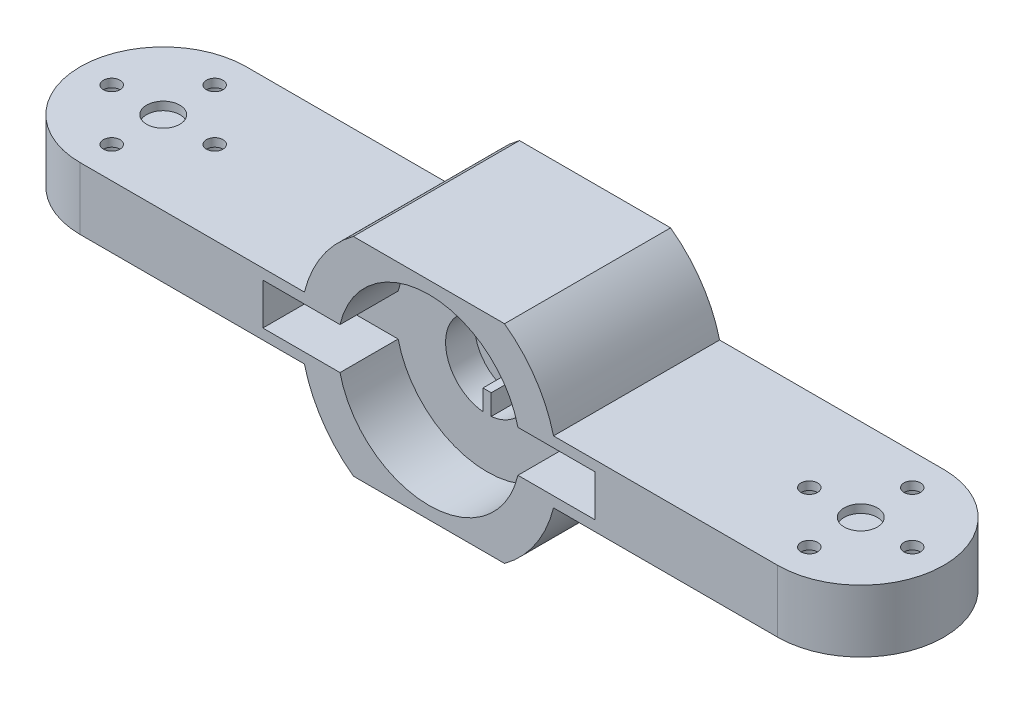
from build123d import *

# Parameters (mm, degrees)
BOSS_EXTRUDE1_DEPTH = 25
SKETCH2_R           = 11
CUT_EXTRUDE1_DEPTH  = 7
CUT_EXTRUDE3_DEPTH  = 8.75
CUT_EXTRUDE5_DEPTH  = 8.75
SKETCH5_R           = 1
CUT_EXTRUDE6_DEPTH  = 7.5
SKETCH6_R           = 1.95
CUT_EXTRUDE7_DEPTH  = 6.5
SKETCH7_R           = 2
CUT_EXTRUDE8_DEPTH  = 1
CUT_EXTRUDE9_DEPTH  = 62.065538563
CUT_EXTRUDE10_DEPTH = 3.5
SKETCH10_W          = 40
SKETCH10_H          = 5
CUT_EXTRUDE11_DEPTH = 7


with BuildPart() as part:
    # Sketch1 → Boss-Extrude1 (new body)
    with BuildSketch(Plane(origin=(0, 0, 0), x_dir=(1, 0, 0), z_dir=(0, 1, 0))):
        with BuildLine():
            Line((-42, -10), (42, -10))
            ThreePointArc((42, -10), (52, 0), (42, 10))
            Line((42, 10), (-42, 10))
            ThreePointArc((-42, 10), (-52, 0), (-42, -10))
        make_face()
    extrude(amount=BOSS_EXTRUDE1_DEPTH)

    # Sketch2 → Cut-Extrude1 (cut)
    with BuildSketch(Plane.XY.offset(10)):
        with Locations((0, 12.5)):
            Circle(SKETCH2_R)
    extrude(amount=-CUT_EXTRUDE1_DEPTH, mode=Mode.SUBTRACT)

    # Sketch3 → Cut-Extrude3 (cut)
    with BuildSketch(Plane.XZ):
        with BuildLine():
            Line((15, -10), (15, 10))
            Line((15, 10), (42, 10))
            ThreePointArc((42, 10), (52, 0), (42, -10))
            Line((42, -10), (15, -10))
        make_face()
        with BuildLine():
            Line((-15, -10), (-15, 10))
            Line((-15, 10), (-42, 10))
            ThreePointArc((-42, 10), (-52, 0), (-42, -10))
            Line((-42, -10), (-15, -10))
        make_face()
    extrude(amount=-CUT_EXTRUDE3_DEPTH, mode=Mode.SUBTRACT)

    # Sketch4 → Cut-Extrude5 (cut)
    with BuildSketch(Plane(origin=(0, 25, 0), x_dir=(1, 0, 0), z_dir=(0, 1, 0))):
        with BuildLine():
            Line((15, -10), (15, 10))
            Line((15, 10), (55, 10))
            ThreePointArc((55, 10), (65, 0), (55, -10))
            Line((55, -10), (15, -10))
        make_face()
        with BuildLine():
            Line((-15, -10), (-15, 10))
            Line((-15, 10), (-55, 10))
            ThreePointArc((-55, 10), (-65, 0), (-55, -10))
            Line((-55, -10), (-15, -10))
        make_face()
    extrude(amount=-CUT_EXTRUDE5_DEPTH, mode=Mode.SUBTRACT)

    # Sketch5 → Cut-Extrude6 (cut)
    with BuildSketch(Plane(origin=(0, 16.25, 0), x_dir=(1, 0, 0), z_dir=(0, 1, 0))):
        with Locations(Location((-42, 6.2, 0), (0, 0, 270))):
            Circle(SKETCH5_R)
        with Locations(Location((-35.8, 0, 0), (0, 0, 270))):
            Circle(SKETCH5_R)
        with Locations(Location((-42, -6.2, 0), (0, 0, 270))):
            Circle(SKETCH5_R)
        with Locations(Location((-48.2, 0, 0), (0, 0, 270))):
            Circle(SKETCH5_R)
        with Locations(Location((42, 6.2, 0), (0, 0, 270))):
            Circle(SKETCH5_R)
        with Locations(Location((48.2, 0, 0), (0, 0, 270))):
            Circle(SKETCH5_R)
        with Locations(Location((42, -6.2, 0), (0, 0, 270))):
            Circle(SKETCH5_R)
        with Locations(Location((35.8, 0, 0), (0, 0, 270))):
            Circle(SKETCH5_R)
    extrude(amount=-CUT_EXTRUDE6_DEPTH, mode=Mode.SUBTRACT)

    # Sketch6 → Cut-Extrude7 (cut)
    with BuildSketch(Plane.XZ.offset(-8.75)):
        with Locations(Location((-42, 6.2, 0), (0, 0, 270))):
            Circle(SKETCH6_R)
        with Locations(Location((-35.8, 0, 0), (0, 0, 270))):
            Circle(SKETCH6_R)
        with Locations(Location((-48.2, 0, 0), (0, 0, 270))):
            Circle(SKETCH6_R)
        with Locations(Location((-42, -6.2, 0), (0, 0, 270))):
            Circle(SKETCH6_R)
        with Locations(Location((42, 6.2, 0), (0, 0, 270))):
            Circle(SKETCH6_R)
        with Locations(Location((48.2, 0, 0), (0, 0, 270))):
            Circle(SKETCH6_R)
        with Locations(Location((35.8, 0, 0), (0, 0, 270))):
            Circle(SKETCH6_R)
        with Locations(Location((42, -6.2, 0), (0, 0, 270))):
            Circle(SKETCH6_R)
    extrude(amount=-CUT_EXTRUDE7_DEPTH, mode=Mode.SUBTRACT)

    # Sketch7 → Cut-Extrude8 (cut)
    with BuildSketch(Plane(origin=(0, 16.25, 0), x_dir=(1, 0, 0), z_dir=(0, 1, 0))):
        with Locations(Location((-42, 0, 0), (0, 0, 270))):
            Circle(SKETCH7_R)
        with Locations(Location((42, 0, 0), (0, 0, 270))):
            Circle(SKETCH7_R)
    extrude(amount=-CUT_EXTRUDE8_DEPTH, mode=Mode.SUBTRACT)

    # Sketch8 → Cut-Extrude9 (cut, through all)
    with BuildSketch(Plane.XY.offset(10)):
        with BuildLine():
            Line((-15, 16.25), (-15, 25))
            Line((-15, 25), (-9.100137362, 25))
            ThreePointArc((-9.100137362, 25), (-12.819702813, 21.143941218), (-15, 16.25))
        make_face()
        with BuildLine():
            Line((15, 0), (9.100137362, 0))
            ThreePointArc((9.100137362, 0), (12.819702813, 3.856058782), (15, 8.75))
            Line((15, 8.75), (15, 0))
        make_face()
        with BuildLine():
            Line((15, 25), (9.100137362, 25))
            ThreePointArc((9.100137362, 25), (12.819702813, 21.143941218), (15, 16.25))
            Line((15, 16.25), (15, 25))
        make_face()
        with BuildLine():
            Line((-15, 0), (-15, 8.75))
            ThreePointArc((-15, 8.75), (-12.819702813, 3.856058782), (-9.100137362, 0))
            Line((-9.100137362, 0), (-15, 0))
        make_face()
    extrude(amount=-CUT_EXTRUDE9_DEPTH, mode=Mode.SUBTRACT)

    # Sketch9 → Cut-Extrude10 (cut)
    with BuildSketch(Plane.XY.offset(3)):
        with BuildLine():
            Line((0.5, 10), (0.5, 7.525062814))
            ThreePointArc((0.5, 7.525062814), (5, 12.5), (0.5, 17.474937186))
            Line((0.5, 17.474937186), (0.5, 15))
            Line((0.5, 15), (-0.5, 15))
            Line((-0.5, 15), (-0.5, 17.474937186))
            ThreePointArc((-0.5, 17.474937186), (-5, 12.5), (-0.5, 7.525062814))
            Line((-0.5, 7.525062814), (-0.5, 10))
            Line((-0.5, 10), (0.5, 10))
        make_face()
    extrude(amount=-CUT_EXTRUDE10_DEPTH, mode=Mode.SUBTRACT)

    # Sketch10 → Cut-Extrude11 (cut)
    with BuildSketch(Plane.XY.offset(10)):
        with Locations((0, 12.5)):
            Rectangle(SKETCH10_W, SKETCH10_H)
    extrude(amount=-CUT_EXTRUDE11_DEPTH, mode=Mode.SUBTRACT)


solid = part.part
